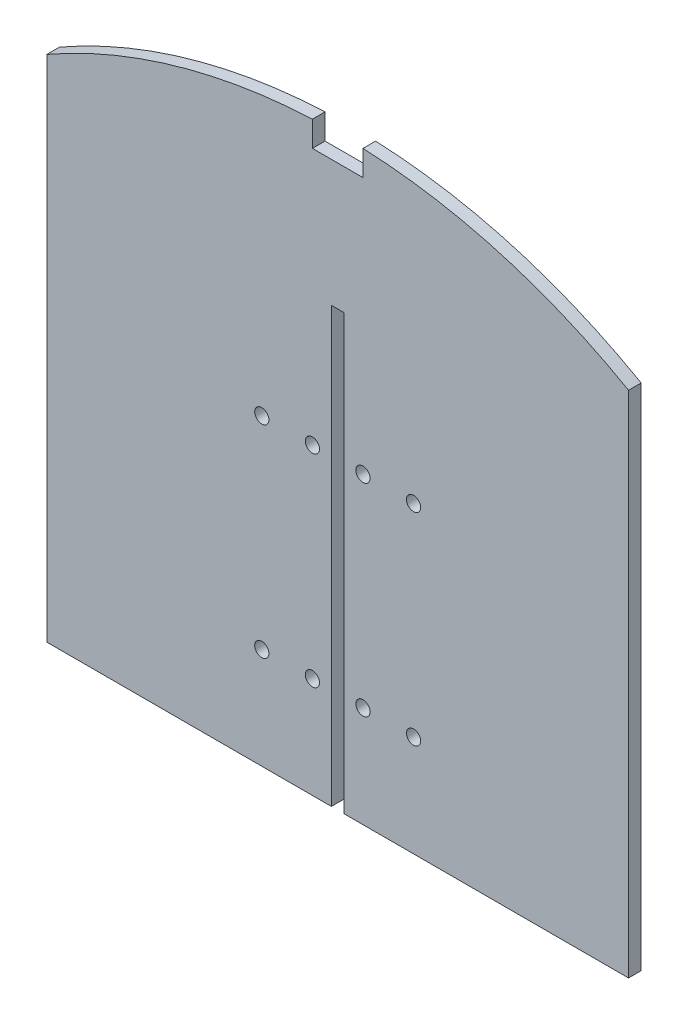
from build123d import *

# Parameters (mm, degrees)
BOSS_EXTRUDE2_DEPTH     = 6.35
CUT_EXTRUDE3_DEPTH      = 148.336
CUT_EXTRUDE3_DEPTH_BACK = 93.472
SKETCH3_R               = 3.5687


with BuildPart() as part:
    # Sketch2 → Boss-Extrude2 (new body)
    with BuildSketch(Plane.XY):
        with BuildLine():
            Line((-3.175, 0), (-3.175, 217.911929367))
            Line((-3.175, 217.911929367), (3.175, 217.911929367))
            Line((3.175, 217.911929367), (3.175, 0))
            Line((3.175, 0), (146.05, 0))
            Line((146.05, 0), (146.05, 255.602258394))
            ThreePointArc((146.05, 255.602258394), (81.677042764, 282.828530529), (12.7, 294.111929367))
            Line((12.7, 294.111929367), (12.7, 281.411929367))
            Line((12.7, 281.411929367), (-12.7, 281.411929367))
            Line((-12.7, 281.411929367), (-12.7, 294.111929367))
            ThreePointArc((-12.7, 294.111929367), (-81.677042764, 282.828530529), (-146.05, 255.602258394))
            Line((-146.05, 255.602258394), (-146.05, 0))
            Line((-146.05, 0), (-3.175, 0))
        make_face()
    extrude(amount=BOSS_EXTRUDE2_DEPTH)

    # Sketch3 → Cut-Extrude3 (cut, two sides: drawn at the far end of the back side and taken through both)
    with BuildSketch(Plane.XY.offset(-CUT_EXTRUDE3_DEPTH_BACK)):
        with Locations(Location((12.7, 50.8, 0), (0, 0, 180))):
            Circle(SKETCH3_R)
        with Locations(Location((38.1, 50.8, 0), (0, 0, 180))):
            Circle(SKETCH3_R)
        with Locations(Location((12.7, 152.4, 0), (0, 0, 180))):
            Circle(SKETCH3_R)
        with Locations(Location((38.1, 152.4, 0), (0, 0, 180))):
            Circle(SKETCH3_R)
        with Locations(Location((-12.7, 50.8, 0), (0, 0, 180))):
            Circle(SKETCH3_R)
        with Locations(Location((-38.1, 50.8, 0), (0, 0, 180))):
            Circle(SKETCH3_R)
        with Locations(Location((-38.1, 152.4, 0), (0, 0, 180))):
            Circle(SKETCH3_R)
        with Locations(Location((-12.7, 152.4, 0), (0, 0, 180))):
            Circle(SKETCH3_R)
    extrude(amount=CUT_EXTRUDE3_DEPTH + CUT_EXTRUDE3_DEPTH_BACK, mode=Mode.SUBTRACT)


solid = part.part
